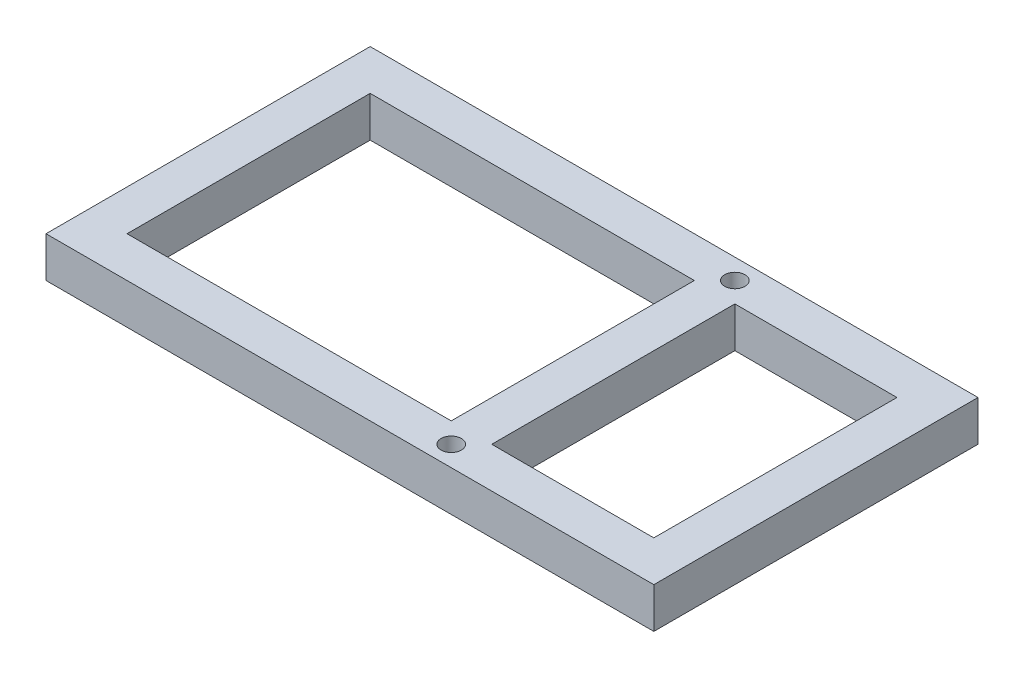
from build123d import *

# Parameters (mm, degrees)
SKETCH1_W           = 150
SKETCH1_H           = 80
BOSS_EXTRUDE1_DEPTH = 10
SKETCH2_W           = 80
SKETCH2_H           = 60
SKETCH2_W_2         = 40
CUT_EXTRUDE1_DEPTH  = 10
SKETCH3_R           = 2.5
CUT_EXTRUDE2_DEPTH  = 86.586213843


with BuildPart() as part:
    # Sketch1 → Boss-Extrude1 (new body)
    with BuildSketch(Plane(origin=(0, 0, 0), x_dir=(1, 0, 0), z_dir=(0, 1, 0))):
        Rectangle(SKETCH1_W, SKETCH1_H)
    extrude(amount=-BOSS_EXTRUDE1_DEPTH)

    # Sketch2 → Cut-Extrude1 (cut)
    with BuildSketch(Plane(origin=(0, 0, 0), x_dir=(1, 0, 0), z_dir=(0, 1, 0))):
        with Locations((-25, 0)):
            Rectangle(SKETCH2_W, SKETCH2_H)
        with Locations((45, 0)):
            Rectangle(SKETCH2_W_2, SKETCH2_H)
    extrude(amount=-CUT_EXTRUDE1_DEPTH, mode=Mode.SUBTRACT)

    # Sketch3 → Cut-Extrude2 (cut, through all)
    with BuildSketch(Plane(origin=(0, 0, 0), x_dir=(1, 0, 0), z_dir=(0, 1, 0))):
        with Locations(Location((20, 35, 0), (0, 0, 270))):
            Circle(SKETCH3_R)
        with Locations(Location((20, -35, 0), (0, 0, 90))):
            Circle(SKETCH3_R)
    extrude(amount=-CUT_EXTRUDE2_DEPTH, mode=Mode.SUBTRACT)


solid = part.part
